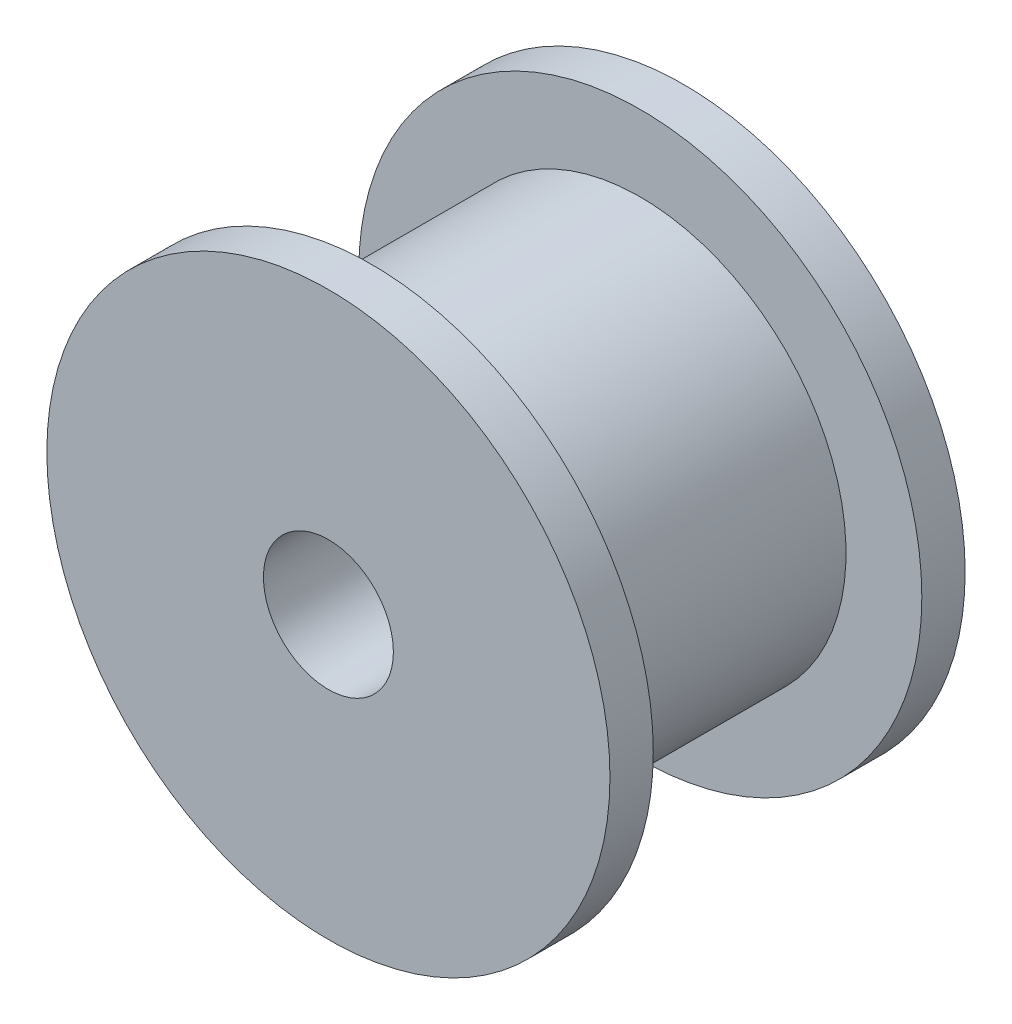
from build123d import *

# Parameters (mm, degrees)
ESQUISSE1_R             = 6.5
BOSS_EXTRU_1_DEPTH      = 1
ESQUISSE2_R             = 4.75
BOSS_EXTRU_2_DEPTH      = 6.2
ESQUISSE3_R             = 6.5
BOSS_EXTRU_3_DEPTH      = 1
ESQUISSE4_R             = 1.5
ENL_V_MAT_EXTRU_1_DEPTH = 10


with BuildPart() as part:
    # Esquisse1 → Boss.-Extru.1 (new body)
    with BuildSketch(Plane.XY):
        Circle(ESQUISSE1_R)
    extrude(amount=BOSS_EXTRU_1_DEPTH)

    # Esquisse2 → Boss.-Extru.2 (add)
    with BuildSketch(Plane.XY.offset(1)):
        with Locations(Location((0, 0, 0), (0, 0, 180))):
            Circle(ESQUISSE2_R)
    extrude(amount=BOSS_EXTRU_2_DEPTH)

    # Esquisse3 → Boss.-Extru.3 (add)
    with BuildSketch(Plane.XY.offset(7.2)):
        Circle(ESQUISSE3_R)
    extrude(amount=BOSS_EXTRU_3_DEPTH)

    # Esquisse4 → Enlèv. mat.-Extru.1 (cut)
    with BuildSketch(Plane.XY.offset(8.2)):
        Circle(ESQUISSE4_R)
    extrude(amount=-ENL_V_MAT_EXTRU_1_DEPTH, mode=Mode.SUBTRACT)


solid = part.part
